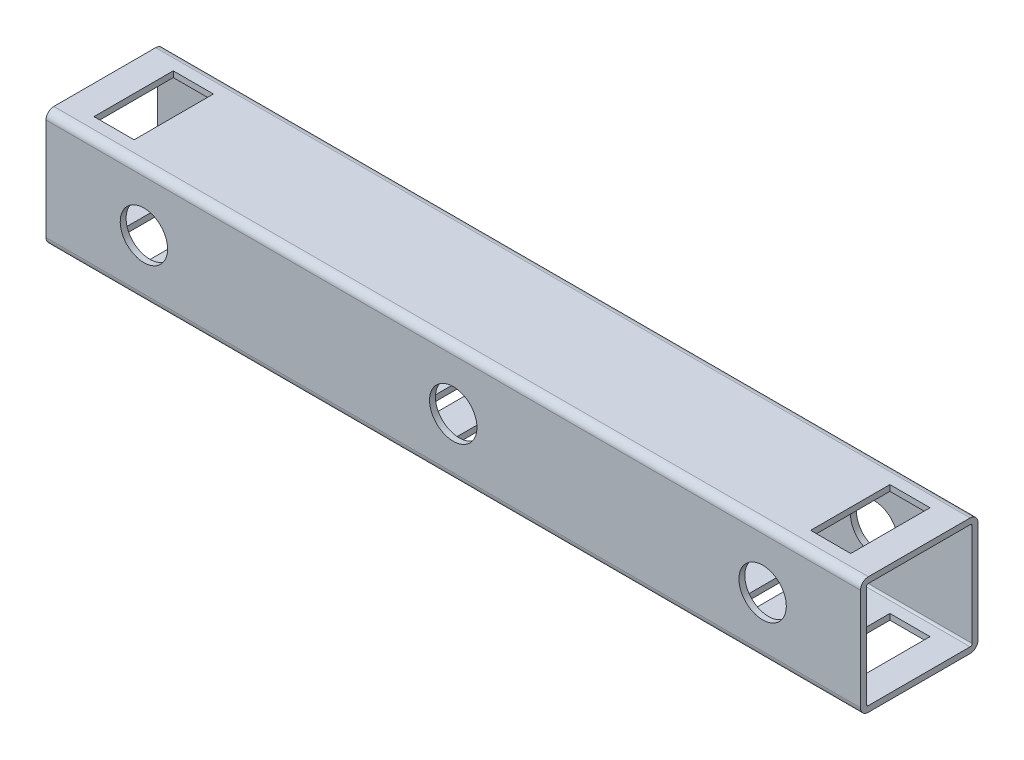
from build123d import *

# Parameters (mm, degrees)
EXTRUDE_1_DEPTH            = 208
SKETCH_3_W                 = 8
SKETCH_3_H                 = 30
CUT_EXTRUDE_1_DEPTH        = 3
PATTERN_LINEAR_1_COUNT     = 6
PATTERN_LINEAR_1_PITCH     = 24
PATTERN_LINEAR_1_COL_COUNT = 7
PATTERN_LINEAR_1_COL_PITCH = 24
CUT_EXTRUDE_2_REACH        = 220.55
SKETCH_5_W                 = 20.5
SKETCH_5_H                 = 40.5
CUT_EXTRUDE_5_REACH        = 220.55
SKETCH_10_R                = 12.1


with BuildPart() as part:
    # Эскиз1 → Бобышка-Вытянуть1 (new, symmetric)
    with BuildSketch(Plane(origin=(0, 0, 0), x_dir=(0, 0, -1), z_dir=(1, 0, 0))):
        with BuildLine():
            Line((-26, -30), (26, -30))
            ThreePointArc((26, -30), (28.828427125, -28.828427125), (30, -26))
            Line((30, -26), (30, 26))
            ThreePointArc((30, 26), (28.828427125, 28.828427125), (26, 30))
            Line((26, 30), (-26, 30))
            ThreePointArc((-26, 30), (-28.828427125, 28.828427125), (-30, 26))
            Line((-30, 26), (-30, -26))
            ThreePointArc((-30, -26), (-28.828427125, -28.828427125), (-26, -30))
        make_face()
        with BuildLine():
            Line((-26, 27), (26, 27))
            ThreePointArc((26, 27), (26.707106781, 26.707106781), (27, 26))
            Line((27, 26), (27, -26))
            ThreePointArc((27, -26), (26.707106781, -26.707106781), (26, -27))
            Line((26, -27), (-26, -27))
            ThreePointArc((-26, -27), (-26.707106781, -26.707106781), (-27, -26))
            Line((-27, -26), (-27, 26))
            ThreePointArc((-27, 26), (-26.707106781, 26.707106781), (-26, 27))
        make_face(mode=Mode.SUBTRACT)
    extrude(amount=EXTRUDE_1_DEPTH, both=True)

    # Эскиз3 → Вырез-Вытянуть1 (cut)
    with BuildSketch(Plane.XZ.offset(30)):
        with Locations((-12, -1)):
            Rectangle(SKETCH_3_W, SKETCH_3_H)
    cut_extrude_1 = extrude(amount=-CUT_EXTRUDE_1_DEPTH, mode=Mode.SUBTRACT)

    # Линейный массив1: Вырез-Вытянуть1 ×6
    with Locations(*[(-i * PATTERN_LINEAR_1_PITCH, 0, 0) for i in range(1, PATTERN_LINEAR_1_COUNT)]):
        add(cut_extrude_1, mode=Mode.SUBTRACT)

    # Линейный массив1 col: Вырез-Вытянуть1 ×7
    with Locations(*[(i * PATTERN_LINEAR_1_COL_PITCH, 0, 0) for i in range(1, PATTERN_LINEAR_1_COL_COUNT)]):
        add(cut_extrude_1, mode=Mode.SUBTRACT)

    # Вырез-Вытянуть2: up to this face of the body (flat: up to its plane)
    cut_extrude_2_end = Plane(part.part.faces().sort_by_distance((0, 30, 0))[0])
    # Эскиз5 → Вырез-Вытянуть2 (cut, up to the picked face)
    with BuildSketch(Plane.XZ.offset(30), mode=Mode.PRIVATE) as cut_extrude_2_sk1:
        with Locations((-183, 0)):
            Rectangle(SKETCH_5_W, SKETCH_5_H)
    cut_extrude_2_tool1 = split(extrude(cut_extrude_2_sk1.sketch, amount=-CUT_EXTRUDE_2_REACH, mode=Mode.PRIVATE), bisect_by=cut_extrude_2_end, keep=Keep.BOTH, mode=Mode.PRIVATE)
    # Эскиз5 → Вырез-Вытянуть2 (cut, up to the picked face)
    with BuildSketch(Plane.XZ.offset(30), mode=Mode.PRIVATE) as cut_extrude_2_sk2:
        with Locations((183, 0)):
            Rectangle(SKETCH_5_W, SKETCH_5_H)
    cut_extrude_2_tool2 = split(extrude(cut_extrude_2_sk2.sketch, amount=-CUT_EXTRUDE_2_REACH, mode=Mode.PRIVATE), bisect_by=cut_extrude_2_end, keep=Keep.BOTH, mode=Mode.PRIVATE)
    add(cut_extrude_2_tool1.solids().sort_by(Axis((-183, -30, 0), (0, 1, 0)))[0], mode=Mode.SUBTRACT)
    add(cut_extrude_2_tool2.solids().sort_by(Axis((183, -30, 0), (0, 1, 0)))[0], mode=Mode.SUBTRACT)

    # Вырез-Вытянуть5: up to this face of the body (flat: up to its plane)
    cut_extrude_5_end = Plane(part.part.faces().sort_by_distance((0, 0, 30))[0])
    # Эскиз10 → Вырез-Вытянуть5 (cut, up to the picked face)
    with BuildSketch(Plane(origin=(0, 0, -30), x_dir=(-1, 0, 0), z_dir=(0, 0, -1)), mode=Mode.PRIVATE) as cut_extrude_5_sk1:
        with Locations(Location((-158, 0, 0), (0, 0, 90))):
            Circle(SKETCH_10_R)
    cut_extrude_5_tool1 = split(extrude(cut_extrude_5_sk1.sketch, amount=-CUT_EXTRUDE_5_REACH, mode=Mode.PRIVATE), bisect_by=cut_extrude_5_end, keep=Keep.BOTH, mode=Mode.PRIVATE)
    # Эскиз10 → Вырез-Вытянуть5 (cut, up to the picked face)
    with BuildSketch(Plane(origin=(0, 0, -30), x_dir=(-1, 0, 0), z_dir=(0, 0, -1)), mode=Mode.PRIVATE) as cut_extrude_5_sk2:
        with Locations(Location((158, 0, 0), (0, 0, 270))):
            Circle(SKETCH_10_R)
    cut_extrude_5_tool2 = split(extrude(cut_extrude_5_sk2.sketch, amount=-CUT_EXTRUDE_5_REACH, mode=Mode.PRIVATE), bisect_by=cut_extrude_5_end, keep=Keep.BOTH, mode=Mode.PRIVATE)
    # Эскиз10 → Вырез-Вытянуть5 (cut, up to the picked face)
    with BuildSketch(Plane(origin=(0, 0, -30), x_dir=(-1, 0, 0), z_dir=(0, 0, -1)), mode=Mode.PRIVATE) as cut_extrude_5_sk3:
        with Locations(Location((0, 0, 0), (0, 0, 90))):
            Circle(SKETCH_10_R)
    cut_extrude_5_tool3 = split(extrude(cut_extrude_5_sk3.sketch, amount=-CUT_EXTRUDE_5_REACH, mode=Mode.PRIVATE), bisect_by=cut_extrude_5_end, keep=Keep.BOTH, mode=Mode.PRIVATE)
    add(cut_extrude_5_tool1.solids().sort_by(Axis((158, 0, -30), (0, 0, 1)))[0], mode=Mode.SUBTRACT)
    add(cut_extrude_5_tool2.solids().sort_by(Axis((-158, 0, -30), (0, 0, 1)))[0], mode=Mode.SUBTRACT)
    add(cut_extrude_5_tool3.solids().sort_by(Axis((0, 0, -30), (0, 0, 1)))[0], mode=Mode.SUBTRACT)


solid = part.part
